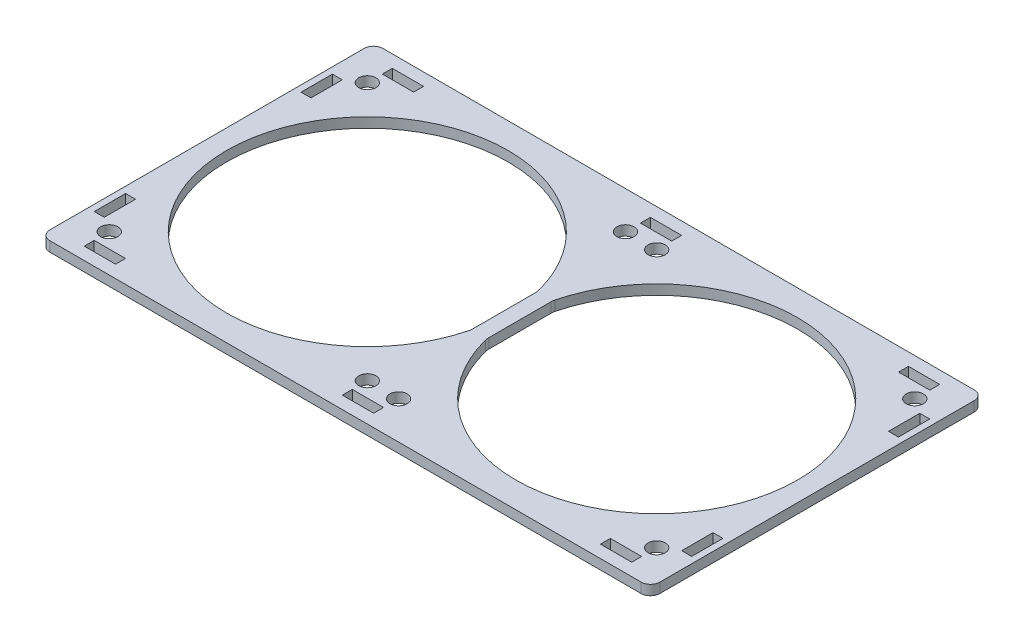
from build123d import *

# Parameters (mm, degrees)
SKETCH1_W           = 195
SKETCH1_H           = 106.45
BOSS_EXTRUDE1_DEPTH = 3.175
SKETCH2_R           = 2.75
CUT_EXTRUDE1_DEPTH  = 112.127095031
FILLET1_R           = 5
FILLET2_R           = 3
SKETCH4_W           = 10
SKETCH4_H           = 3.175
SKETCH4_W_2         = 3.175
SKETCH4_H_2         = 10
CUT_EXTRUDE2_DEPTH  = 112.127095031


with BuildPart() as part:
    # Sketch1 → Boss-Extrude1 (new body)
    with BuildSketch(Plane(origin=(0, 0, 0), x_dir=(1, 0, 0), z_dir=(0, 1, 0))):
        Rectangle(SKETCH1_W, SKETCH1_H)
    extrude(amount=BOSS_EXTRUDE1_DEPTH)

    # Sketch2 → Cut-Extrude1 (cut, through all)
    with BuildSketch(Plane(origin=(0, 3.175, 0), x_dir=(1, 0, 0), z_dir=(0, 1, 0))):
        with Locations((-87.5, 41.25)):
            Circle(SKETCH2_R)
        with Locations((-5, 41.25)):
            Circle(SKETCH2_R)
        with Locations((-5, -41.25)):
            Circle(SKETCH2_R)
        with Locations((-87.5, -41.25)):
            Circle(SKETCH2_R)
        with Locations((5, 41.25)):
            Circle(SKETCH2_R)
        with Locations((5, -41.25)):
            Circle(SKETCH2_R)
        with Locations((87.5, -41.25)):
            Circle(SKETCH2_R)
        with Locations((87.5, 41.25)):
            Circle(SKETCH2_R)
        with BuildLine():
            Line((-2.5, 10.532687216), (-2.5, -10.532687216))
            ThreePointArc((-2.5, -10.532687216), (-91.25, 0), (-2.5, 10.532687216))
        make_face()
        with BuildLine():
            Line((2.5, 10.532687216), (2.5, -10.532687216))
            ThreePointArc((2.5, -10.532687216), (91.25, 0), (2.5, 10.532687216))
        make_face()
    extrude(amount=-CUT_EXTRUDE1_DEPTH, mode=Mode.SUBTRACT)

    # Fillet1
    fillet1_edges = [part.edges().sort_by_distance(p)[0] for p in [
        (-2.5, 1.5875, -10.532687216),
        (-2.5, 1.5875, 10.532687216),
        (2.5, 1.5875, 10.532687216),
        (2.5, 1.5875, -10.532687216),
    ]]
    fillet(fillet1_edges, radius=FILLET1_R)

    # Fillet2
    fillet2_edges = [part.edges().sort_by_distance(p)[0] for p in [
        (97.5, 1.5875, -53.225),
        (97.5, 1.5875, 53.225),
        (-97.5, 1.5875, 53.225),
        (-97.5, 1.5875, -53.225),
    ]]
    fillet(fillet2_edges, radius=FILLET2_R)

    # Sketch4 → Cut-Extrude2 (cut, through all)
    with BuildSketch(Plane.XZ):
        with Locations((-82.5, 47.6375)):
            Rectangle(SKETCH4_W, SKETCH4_H)
        with Locations((0, 47.6375)):
            Rectangle(SKETCH4_W, SKETCH4_H)
        with Locations((82.5, 47.6375)):
            Rectangle(SKETCH4_W, SKETCH4_H)
        with Locations((82.5, -47.6375)):
            Rectangle(SKETCH4_W, SKETCH4_H)
        with Locations((0, -47.6375)):
            Rectangle(SKETCH4_W, SKETCH4_H)
        with Locations((-82.5, -47.6375)):
            Rectangle(SKETCH4_W, SKETCH4_H)
        with Locations((93.8875, -33.05)):
            Rectangle(SKETCH4_W_2, SKETCH4_H_2)
        with Locations((93.8875, 33.05)):
            Rectangle(SKETCH4_W_2, SKETCH4_H_2)
        with Locations((-93.8875, 33.05)):
            Rectangle(SKETCH4_W_2, SKETCH4_H_2)
        with Locations((-93.8875, -33.05)):
            Rectangle(SKETCH4_W_2, SKETCH4_H_2)
    extrude(amount=-CUT_EXTRUDE2_DEPTH, mode=Mode.SUBTRACT)


solid = part.part
